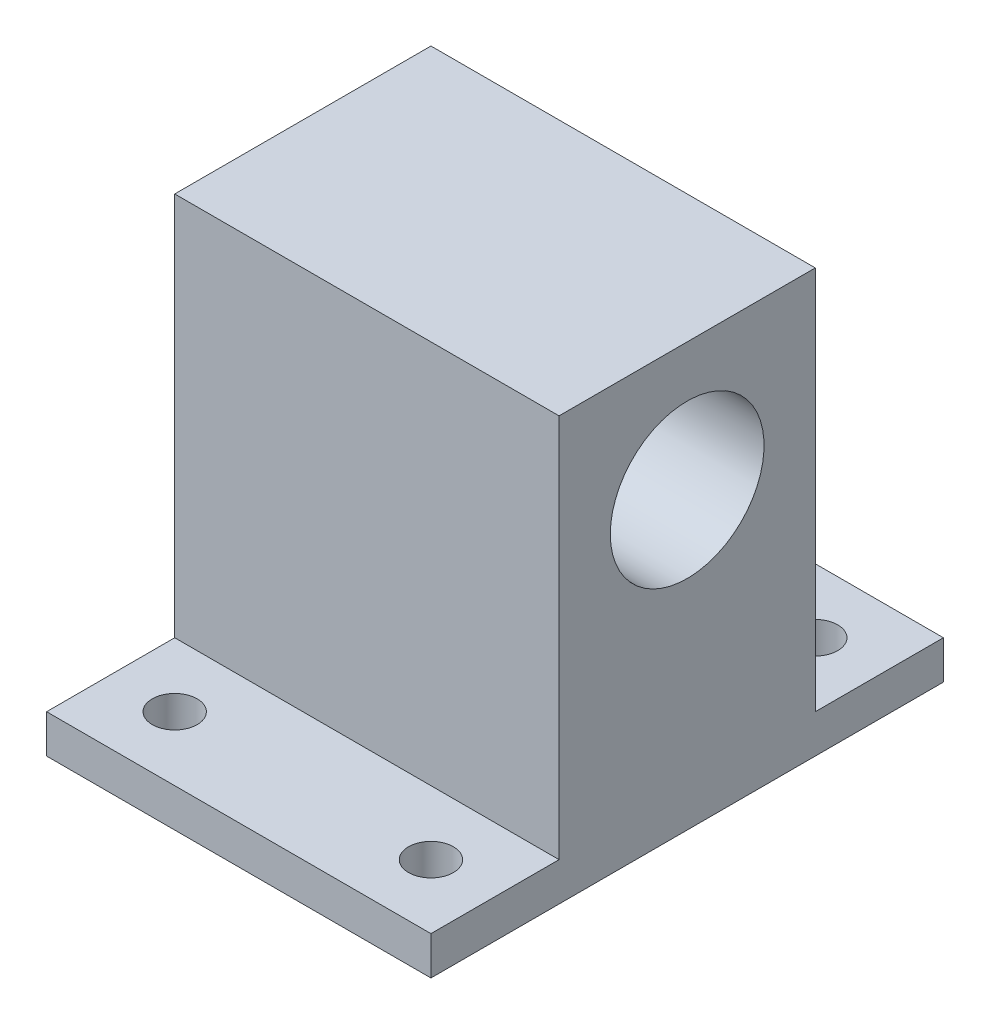
from build123d import *

# Parameters (mm, degrees)
SKETCH1_W           = 30
SKETCH1_H           = 40
SKETCH1_R           = 1.75
BOSS_EXTRUDE2_DEPTH = 3
SKETCH2_W           = 30
SKETCH2_H           = 20
BOSS_EXTRUDE3_DEPTH = 30
SKETCH3_R           = 6
CUT_EXTRUDE1_DEPTH  = 30


with BuildPart() as part:
    # Sketch1 → Boss-Extrude2 (new body)
    with BuildSketch(Plane(origin=(0, 0, 0), x_dir=(1, 0, 0), z_dir=(0, 1, 0))):
        Rectangle(SKETCH1_W, SKETCH1_H)
        with Locations(Location((-10, 15, 0), (0, 0, 270))):
            Circle(SKETCH1_R, mode=Mode.SUBTRACT)
        with Locations(Location((10, 15, 0), (0, 0, 270))):
            Circle(SKETCH1_R, mode=Mode.SUBTRACT)
        with Locations(Location((10, -15, 0), (0, 0, 270))):
            Circle(SKETCH1_R, mode=Mode.SUBTRACT)
        with Locations(Location((-10, -15, 0), (0, 0, 270))):
            Circle(SKETCH1_R, mode=Mode.SUBTRACT)
    extrude(amount=BOSS_EXTRUDE2_DEPTH)

    # Sketch2 → Boss-Extrude3 (add)
    with BuildSketch(Plane(origin=(0, 3, 0), x_dir=(1, 0, 0), z_dir=(0, 1, 0))):
        Rectangle(SKETCH2_W, SKETCH2_H)
    extrude(amount=BOSS_EXTRUDE3_DEPTH)

    # Sketch3 → Cut-Extrude1 (cut)
    with BuildSketch(Plane.ZY.offset(15)):
        with Locations((0, 23)):
            Circle(SKETCH3_R)
    extrude(amount=-CUT_EXTRUDE1_DEPTH, mode=Mode.SUBTRACT)


solid = part.part
